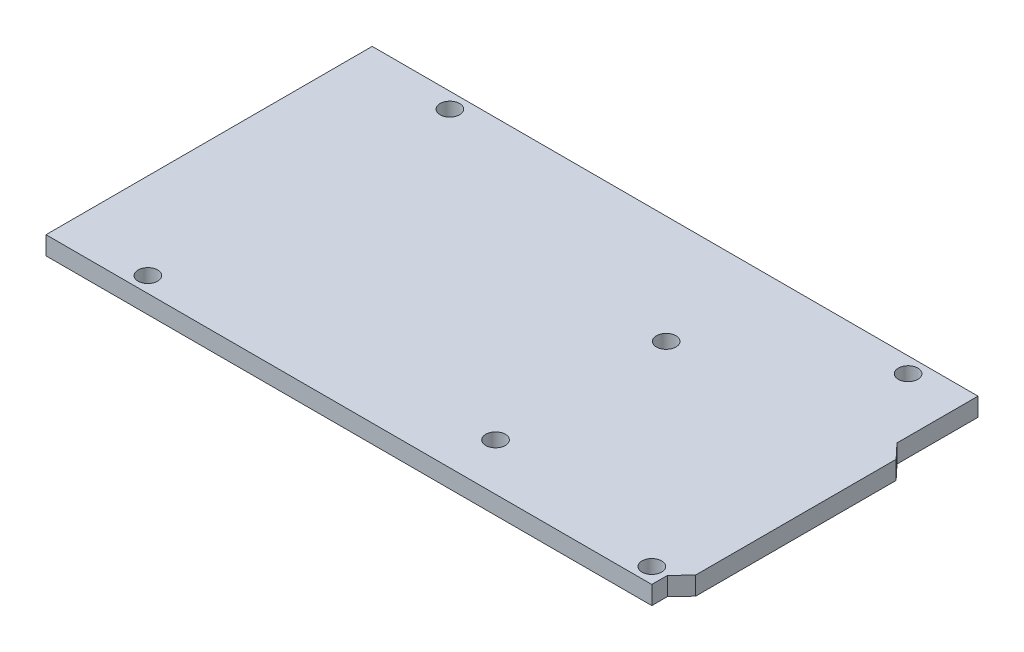
from build123d import *

# Parameters (mm, degrees)
SKETCH1_R           = 1.599321613
SKETCH1_R_2         = 1.6
BOSS_EXTRUDE1_DEPTH = 3


with BuildPart() as part:
    # Sketch1 → Boss-Extrude1 (new body)
    with BuildSketch(Plane(origin=(0, 0, 0), x_dir=(1, 0, 0), z_dir=(0, 1, 0))):
        Polygon((49.53, -24.13), (51.78, -21.74), (51.78, 11.03), (49.53, 13.42), (49.53, 26.67), (-49.53, 26.67), (-49.53, -26.67), (49.53, -26.67), align=None)
        with Locations(Location((-34.29, 24.13, 0), (0, 0, 270))):
            Circle(SKETCH1_R, mode=Mode.SUBTRACT)
        with Locations(Location((40.64, 24.13, 0), (0, 0, 270))):
            Circle(SKETCH1_R_2, mode=Mode.SUBTRACT)
        with Locations(Location((46.99, -24.13, 0), (0, 0, 270))):
            Circle(SKETCH1_R_2, mode=Mode.SUBTRACT)
        with Locations(Location((-35.41, -24.13, 0), (0, 0, 270))):
            Circle(SKETCH1_R_2, mode=Mode.SUBTRACT)
        with Locations(Location((16.28, 8.93, 0), (0, 0, 270))):
            Circle(SKETCH1_R_2, mode=Mode.SUBTRACT)
        with Locations(Location((16.28, -18.97, 0), (0, 0, 270))):
            Circle(SKETCH1_R_2, mode=Mode.SUBTRACT)
    extrude(amount=BOSS_EXTRUDE1_DEPTH)


solid = part.part
